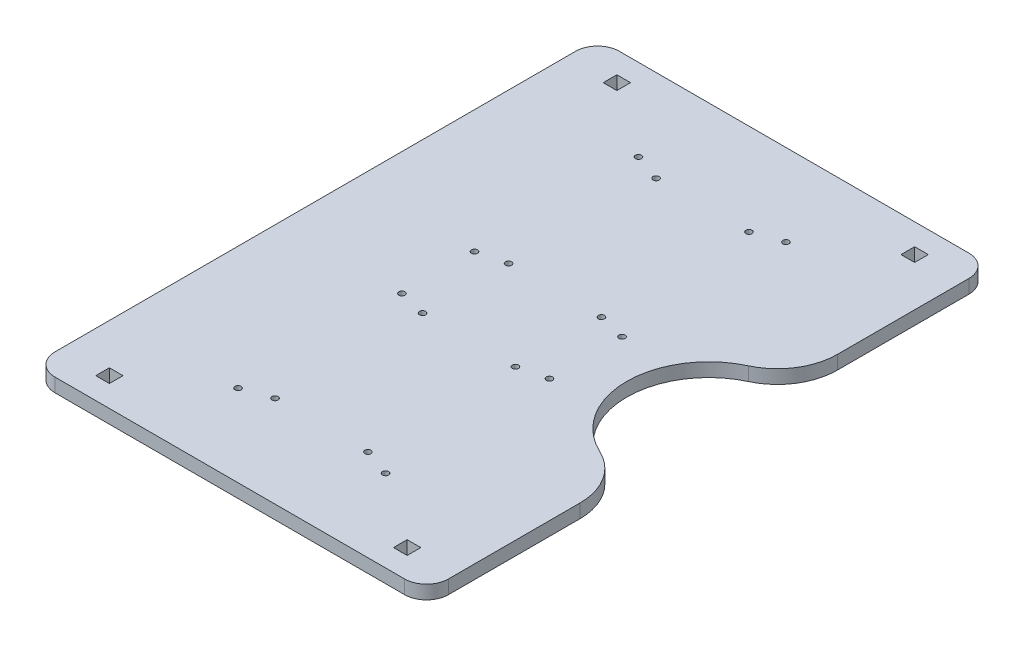
from build123d import *

# Parameters (mm, degrees)
SKETCH3_R           = 1.4224
SKETCH3_W           = 6.35
SKETCH3_H           = 6.35
BOSS_EXTRUDE1_DEPTH = 6.35
FILLET1_R           = 10.16
FILLET2_R           = 27.94


with BuildPart() as part:
    # Sketch3 → Boss-Extrude1 (new body)
    with BuildSketch(Plane(origin=(0, 0, 0), x_dir=(1, 0, 0), z_dir=(0, 1, 0))):
        with BuildLine():
            Line((182.88, 0), (0, 0))
            Line((0, 0), (0, 262.339276313))
            Line((0, 262.339276313), (182.88, 262.339276313))
            Line((182.88, 262.339276313), (182.88, 169.269638157))
            ThreePointArc((182.88, 169.269638157), (144.78, 131.169638157), (182.88, 93.069638157))
            Line((182.88, 93.069638157), (182.88, 0))
        make_face()
        with Locations(Location((57.15, 38.1, 0), (0, 0, 270))):
            Circle(SKETCH3_R, mode=Mode.SUBTRACT)
        with Locations(Location((57.15, 114.3, 0), (0, 0, 270))):
            Circle(SKETCH3_R, mode=Mode.SUBTRACT)
        with Locations(Location((125.73, 114.3, 0), (0, 0, 90))):
            Circle(SKETCH3_R, mode=Mode.SUBTRACT)
        with Locations(Location((125.73, 38.1, 0), (0, 0, 90))):
            Circle(SKETCH3_R, mode=Mode.SUBTRACT)
        with Locations(Location((69.85, 151.157668748, 0), (0, 0, 270))):
            Circle(SKETCH3_R, mode=Mode.SUBTRACT)
        with Locations(Location((69.85, 219.737668748, 0), (0, 0, 270))):
            Circle(SKETCH3_R, mode=Mode.SUBTRACT)
        with Locations(Location((113.03, 151.157668748, 0), (0, 0, 90))):
            Circle(SKETCH3_R, mode=Mode.SUBTRACT)
        with Locations(Location((113.03, 219.737668748, 0), (0, 0, 90))):
            Circle(SKETCH3_R, mode=Mode.SUBTRACT)
        with Locations(Location((113.03, 42.601607565, 0), (0, 0, 270))):
            Circle(SKETCH3_R, mode=Mode.SUBTRACT)
        with Locations(Location((113.03, 111.181607565, 0), (0, 0, 270))):
            Circle(SKETCH3_R, mode=Mode.SUBTRACT)
        with Locations(Location((69.85, 111.181607565, 0), (0, 0, 90))):
            Circle(SKETCH3_R, mode=Mode.SUBTRACT)
        with Locations(Location((69.85, 42.601607565, 0), (0, 0, 90))):
            Circle(SKETCH3_R, mode=Mode.SUBTRACT)
        with Locations(Location((125.73, 148.039276313, 0), (0, 0, 270))):
            Circle(SKETCH3_R, mode=Mode.SUBTRACT)
        with Locations(Location((125.73, 224.239276313, 0), (0, 0, 270))):
            Circle(SKETCH3_R, mode=Mode.SUBTRACT)
        with Locations(Location((57.15, 224.239276313, 0), (0, 0, 90))):
            Circle(SKETCH3_R, mode=Mode.SUBTRACT)
        with Locations(Location((57.15, 148.039276313, 0), (0, 0, 90))):
            Circle(SKETCH3_R, mode=Mode.SUBTRACT)
        with Locations((22.225, 13.212735966)):
            Rectangle(SKETCH3_W, SKETCH3_H, mode=Mode.SUBTRACT)
        with Locations((160.655, 13.212735966)):
            Rectangle(SKETCH3_W, SKETCH3_H, mode=Mode.SUBTRACT)
        with Locations((160.655, 249.126540348)):
            Rectangle(SKETCH3_W, SKETCH3_H, mode=Mode.SUBTRACT)
        with Locations((22.225, 249.126540348)):
            Rectangle(SKETCH3_W, SKETCH3_H, mode=Mode.SUBTRACT)
    extrude(amount=BOSS_EXTRUDE1_DEPTH)

    # Fillet1
    fillet1_edges = [part.edges().sort_by_distance(p)[0] for p in [
        (0, 3.175, -262.339276313),
        (182.88, 3.175, -262.339276313),
        (182.88, 3.175, 0),
        (0, 3.175, 0),
    ]]
    fillet(fillet1_edges, radius=FILLET1_R)

    # Fillet2
    fillet2_edges = [part.edges().sort_by_distance(p)[0] for p in [
        (182.88, 3.175, -169.269638157),
        (182.88, 3.175, -93.069638157),
    ]]
    fillet(fillet2_edges, radius=FILLET2_R)


solid = part.part
